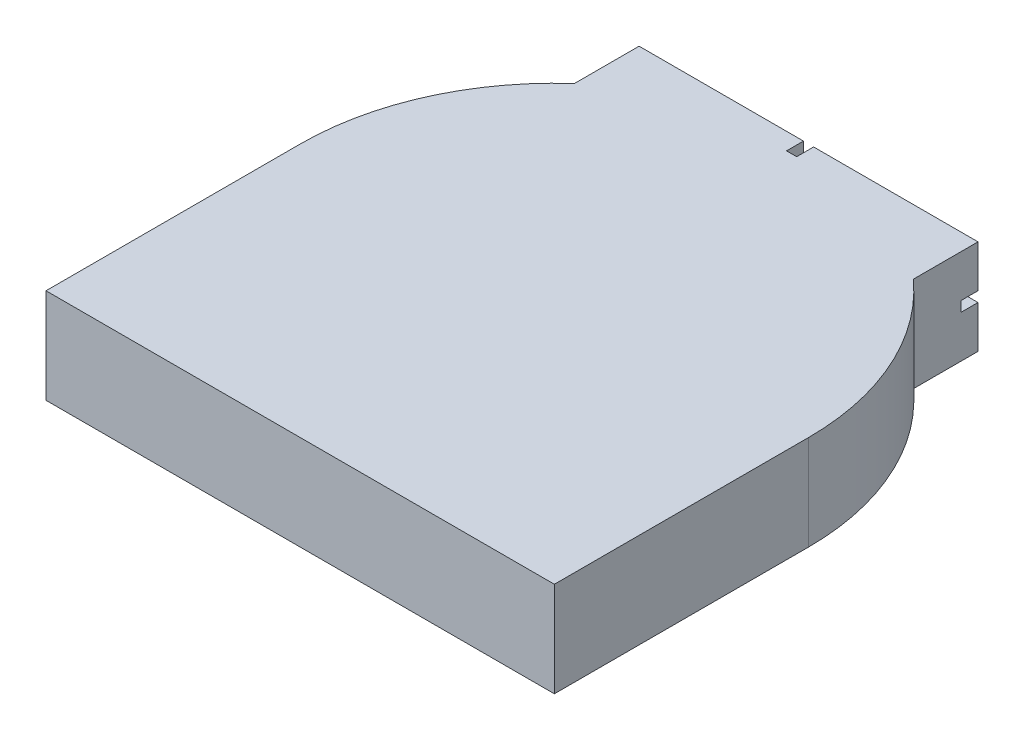
from build123d import *

# Parameters (mm, degrees)
BOSS_EXTRUDE1_DEPTH = 0.8
BOSS_EXTRUDE2_DEPTH = 1
BOSS_EXTRUDE3_START = 1
BOSS_EXTRUDE3_DEPTH = 1
CUT_EXTRUDE1_DEPTH  = 0.5


with BuildPart() as part:
    # Sketch1 → Boss-Extrude1 (new body)
    with BuildSketch(Plane(origin=(0, 0, 0), x_dir=(1, 0, 0), z_dir=(0, 1, 0))):
        with BuildLine():
            Line((-5, 7.5), (-5, 5.590169944))
            ThreePointArc((-5, 5.590169944), (-6.846531969, 3.061862178), (-7.5, 0))
            Line((-7.5, 0), (-7.5, -7.5))
            Line((-7.5, -7.5), (7.5, -7.5))
            Line((7.5, -7.5), (7.5, 0))
            ThreePointArc((7.5, 0), (6.846531969, 3.061862178), (5, 5.590169944))
            Line((5, 5.590169944), (5, 7.5))
            Line((5, 7.5), (3, 7.5))
            Line((3, 7.5), (3, 5.5))
            Line((3, 5.5), (3, 5.123475383))
            ThreePointArc((3, 5.123475383), (3.101282966, 4.684946373), (3.384615385, 4.335248401))
            ThreePointArc((3.384615385, 4.335248401), (0, -5.5), (-3.384615385, 4.335248401))
            ThreePointArc((-3.384615385, 4.335248401), (-3.101282966, 4.684946373), (-3, 5.123475383))
            Line((-3, 5.123475383), (-3, 5.5))
            Line((-3, 5.5), (-3, 7.5))
            Line((-3, 7.5), (-5, 7.5))
        make_face()
    extrude(amount=BOSS_EXTRUDE1_DEPTH)

    # Sketch2 → Boss-Extrude2 (add)
    with BuildSketch(Plane(origin=(0, 0.8, 0), x_dir=(1, 0, 0), z_dir=(0, 1, 0))):
        with BuildLine():
            Line((5, 5.590169944), (5, 7.5))
            Line((5, 7.5), (3, 7.5))
            Line((3, 7.5), (-3, 7.5))
            Line((-3, 7.5), (-5, 7.5))
            Line((-5, 7.5), (-5, 5.590169944))
            ThreePointArc((-5, 5.590169944), (-6.846531969, 3.061862178), (-7.5, 0))
            Line((-7.5, 0), (-7.5, -7.5))
            Line((-7.5, -7.5), (7.5, -7.5))
            Line((7.5, -7.5), (7.5, 0))
            ThreePointArc((7.5, 0), (6.846531969, 3.061862178), (5, 5.590169944))
        make_face()
    extrude(amount=BOSS_EXTRUDE2_DEPTH)

    # Sketch3 → Boss-Extrude3 (add)
    with BuildSketch(Plane.XZ.offset(BOSS_EXTRUDE3_START)):
        with BuildLine():
            Line((-3, -7.5), (-5, -7.5))
            Line((-5, -7.5), (-5, -5.590169944))
            ThreePointArc((-5, -5.590169944), (-6.846531969, -3.061862178), (-7.5, 0))
            Line((-7.5, 0), (-7.5, 7.5))
            Line((-7.5, 7.5), (7.5, 7.5))
            Line((7.5, 7.5), (7.5, 0))
            ThreePointArc((7.5, 0), (6.846531969, -3.061862178), (5, -5.590169944))
            Line((5, -5.590169944), (5, -7.5))
            Line((5, -7.5), (3, -7.5))
            Line((3, -7.5), (-3, -7.5))
        make_face()
    extrude(amount=-BOSS_EXTRUDE3_DEPTH)

    # Sketch4 → Cut-Extrude1 (cut)
    with BuildSketch(Plane(origin=(0, 0, -7.5), x_dir=(-1, 0, 0), z_dir=(0, 0, -1))):
        Polygon((-5, 0.55), (-0.15, 0.55), (-0.15, 1.8), (0.15, 1.8), (0.15, 0.55), (5, 0.55), (5, 0.25), (0.15, 0.25), (0.15, -1), (-0.15, -1), (-0.15, 0.25), (-5, 0.25), align=None)
    extrude(amount=-CUT_EXTRUDE1_DEPTH, mode=Mode.SUBTRACT)


solid = part.part
